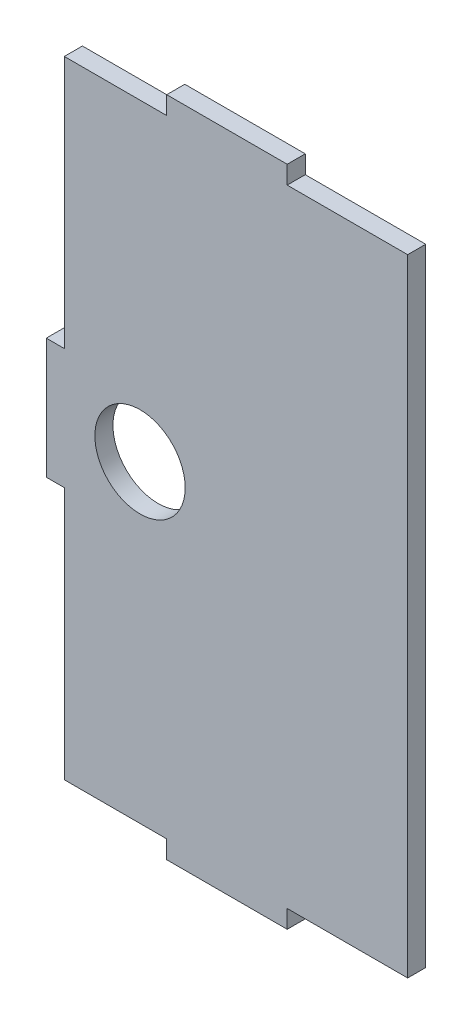
from build123d import *

# Parameters (mm, degrees)
BOSS_EXTRUDE1_DEPTH = 3
SKETCH3_R           = 7.5
CUT_EXTRUDE1_DEPTH  = 10
SKETCH4_W           = 3
SKETCH4_H           = 20
BOSS_EXTRUDE2_DEPTH = 3


with BuildPart() as part:
    # Sketch1 → Boss-Extrude1 (new body)
    with BuildSketch(Plane.XY):
        Polygon((-10, 52), (-10, 55), (10, 55), (10, 52), (30, 52), (30, -52), (10, -52), (10, -55), (-10, -55), (-10, -52), (-27, -52), (-27, 52), align=None)
    extrude(amount=BOSS_EXTRUDE1_DEPTH)

    # Sketch3 → Cut-Extrude1 (cut)
    with BuildSketch(Plane.XY.offset(3)):
        with Locations((-14.432858662, 0)):
            Circle(SKETCH3_R)
    extrude(amount=-CUT_EXTRUDE1_DEPTH, mode=Mode.SUBTRACT)

    # Sketch4 → Boss-Extrude2 (add)
    with BuildSketch(Plane.ZY.offset(27)):
        with Locations((1.5, 0)):
            Rectangle(SKETCH4_W, SKETCH4_H)
    extrude(amount=BOSS_EXTRUDE2_DEPTH)


solid = part.part
